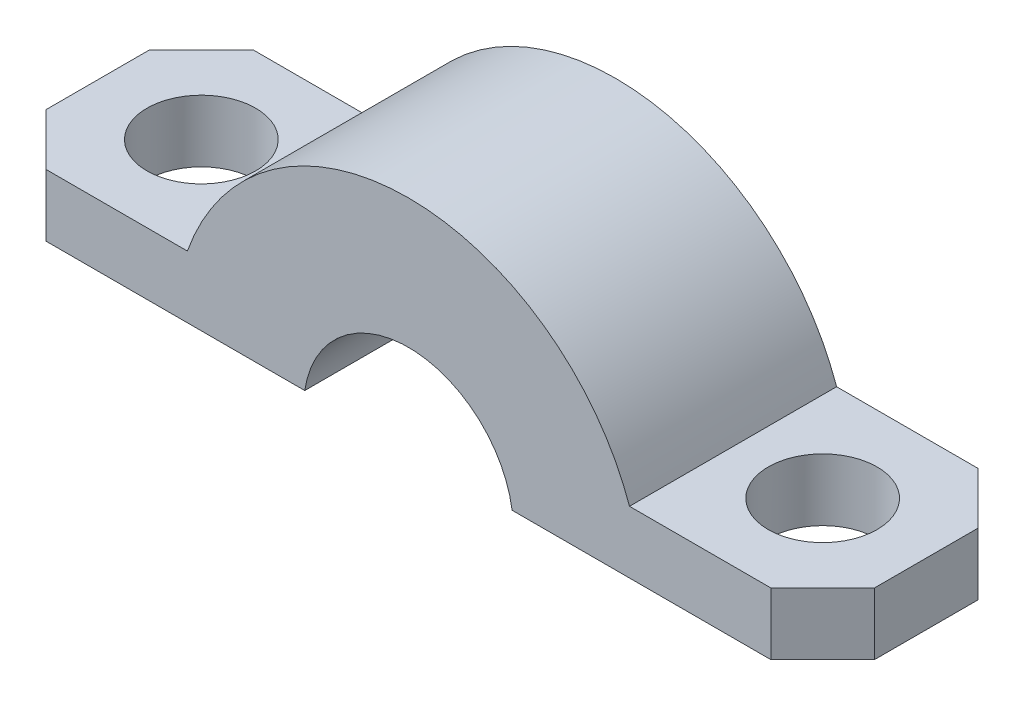
from build123d import *

# Parameters (mm, degrees)
BOSS_EXTRUDE1_DEPTH = 4
SKETCH2_R           = 2.1
CUT_EXTRUDE1_DEPTH  = 19.812296511
SKETCH3_W           = 40
SKETCH3_H           = 10
CUT_EXTRUDE2_DEPTH  = 0.6
CHAMFER1_SIZE       = 2


with BuildPart() as part:
    # Sketch1 → Boss-Extrude1 (new, symmetric)
    with BuildSketch(Plane.XY):
        with BuildLine():
            Line((-4.05, 0), (-16, 0))
            Line((-16, 0), (-16, 3))
            Line((-16, 3), (-8.538296083, 3))
            ThreePointArc((-8.538296083, 3), (0, 9.05), (8.538296083, 3))
            Line((8.538296083, 3), (16, 3))
            Line((16, 3), (16, 0))
            Line((16, 0), (4.05, 0))
            ThreePointArc((4.05, 0), (0, 4.05), (-4.05, 0))
        make_face()
    extrude(amount=BOSS_EXTRUDE1_DEPTH, both=True)

    # Sketch2 → Cut-Extrude1 (cut, through all)
    with BuildSketch(Plane(origin=(0, 0, 0), x_dir=(1, 0, 0), z_dir=(0, 1, 0))):
        with Locations((-12, 0)):
            Circle(SKETCH2_R)
        with Locations((12, 0)):
            Circle(SKETCH2_R)
    extrude(amount=CUT_EXTRUDE1_DEPTH, mode=Mode.SUBTRACT)

    # Sketch3 → Cut-Extrude2 (cut)
    with BuildSketch(Plane(origin=(0, 0, 0), x_dir=(1, 0, 0), z_dir=(0, 1, 0))):
        Rectangle(SKETCH3_W, SKETCH3_H)
    extrude(amount=CUT_EXTRUDE2_DEPTH, mode=Mode.SUBTRACT)

    # Chamfer1
    chamfer1_edges = [part.edges().sort_by_distance(p)[0] for p in [
        (-16, 1.8, 4),
        (16, 1.8, -4),
        (16, 1.8, 4),
        (-16, 1.8, -4),
    ]]
    chamfer(chamfer1_edges, length=CHAMFER1_SIZE)


solid = part.part
